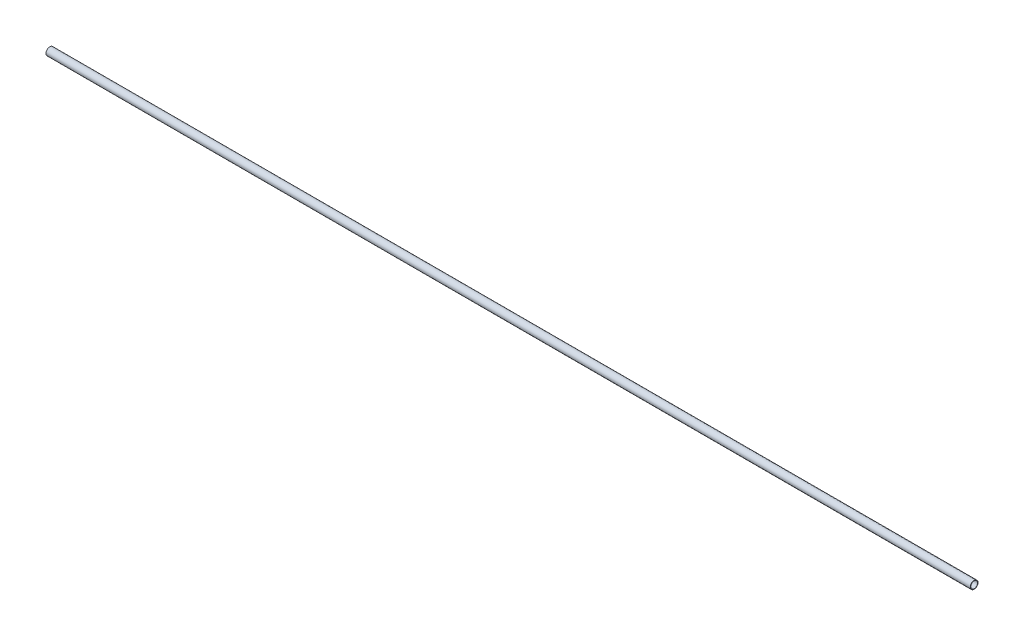
from build123d import *

# Parameters (mm, degrees)
SKETCH1_R      = 6.35
SKETCH1_R_2    = 5.6388
EXTRUDE1_DEPTH = 762


with BuildPart() as part:
    # Sketch1 → Extrude1 (new, symmetric)
    with BuildSketch(Plane(origin=(0, 0, 0), x_dir=(0, 0, -1), z_dir=(1, 0, 0))):
        Circle(SKETCH1_R)
        Circle(SKETCH1_R_2, mode=Mode.SUBTRACT)
    extrude(amount=EXTRUDE1_DEPTH, both=True)


solid = part.part
